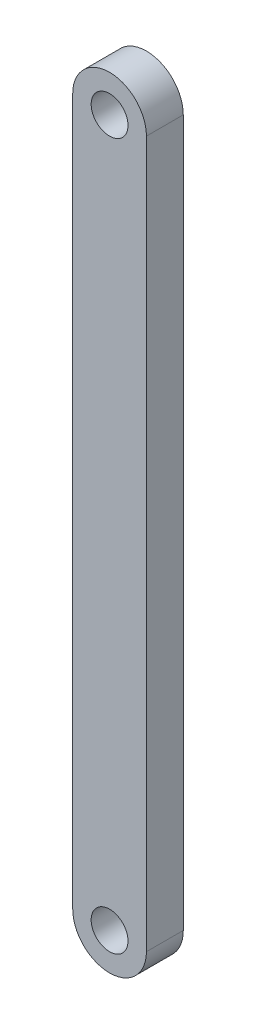
from build123d import *

# Parameters (mm, degrees)
CROQUIS1_R              = 3
SALIENTE_EXTRUIR1_DEPTH = 6


with BuildPart() as part:
    # Croquis1 → Saliente-Extruir1 (new body)
    with BuildSketch(Plane.XY):
        with BuildLine():
            Line((-6, 0), (-6, 115))
            ThreePointArc((-6, 115), (0, 121), (6, 115))
            Line((6, 115), (6, 0))
            ThreePointArc((6, 0), (0, -6), (-6, 0))
        make_face()
        Circle(CROQUIS1_R, mode=Mode.SUBTRACT)
        with Locations((0, 115)):
            Circle(CROQUIS1_R, mode=Mode.SUBTRACT)
    extrude(amount=SALIENTE_EXTRUIR1_DEPTH)


solid = part.part
